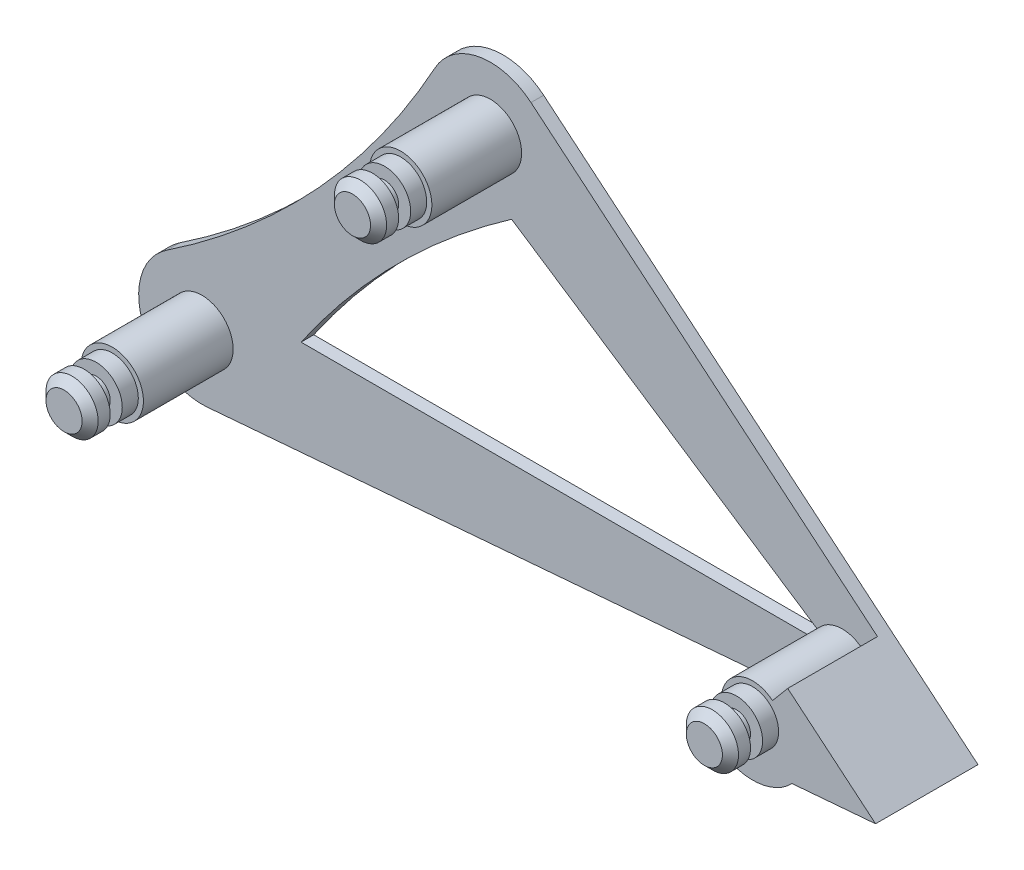
from build123d import *

# Parameters (mm, degrees)
BOSS_EXTRU_1_DEPTH      = 1.58
BOSS_EXTRU_2_START      = 1.58
ESQUISSE1_3_R           = 3.886
BOSS_EXTRU_2_DEPTH      = 11.18
ESQUISSE2_R             = 3.25
BOSS_EXTRU_3_DEPTH      = 6
ENL_V_START             = -4
ESQUISSE3_R             = 3.25
ESQUISSE3_R_2           = 1.75
ENL_V_MAT_EXTRU_1_DEPTH = 1.5
CHANFREIN1_SIZE         = 1
BOSS_EXTRU_4_DEPTH      = 11.18


with BuildPart() as part:
    # Esquisse1 → Boss.-Extru.1 (new body)
    with BuildSketch(Plane(origin=(0, 0, 0), x_dir=(0, 1, 0), z_dir=(0, 0, 1))):
        with BuildLine():
            Line((0, 0), (45.165601039, 54.106615925))
            ThreePointArc((45.165601039, 54.106615925), (46.861742083, 60.617851904), (42.915866667, 66.067912051))
            ThreePointArc((42.915866667, 66.067912051), (22.728037477, 80.578228894), (6.560916882, 99.465313208))
            ThreePointArc((6.560916882, 99.465313208), (-2.597046188, 102.536096098), (-7.8588344, 94.43599857))
            Line((-7.8588344, 94.43599857), (0, 0))
        make_face()
        with BuildLine():
            ThreePointArc((5, 82.745942394), (19.367183897, 70.819861934), (31.370252193, 56.516934969))
            Line((31.370252193, 56.516934969), (6.201435733, 18.446635033))
            ThreePointArc((6.201435733, 18.446635033), (5.626939889, 18.799985682), (5, 19.048679333))
            Line((5, 19.048679333), (5, 82.745942394))
        make_face(mode=Mode.SUBTRACT)
    extrude(amount=BOSS_EXTRU_1_DEPTH)

    # Esquisse1<3> → Boss.-Extru.2 (add)
    with BuildSketch(Plane(origin=(0, 0, 0), x_dir=(0, 1, 0), z_dir=(0, 0, 1)).offset(BOSS_EXTRU_2_START)):
        with Locations(Location((0, 95.09, 0), (0, 0, 90))):
            Circle(ESQUISSE1_3_R)
        with Locations(Location((39.111633766, 59.160176675, 0), (0, 0, 90))):
            Circle(ESQUISSE1_3_R)
        with Locations(Location((3.886, 15.325777239, 0), (0, 0, 73.341295749))):
            Circle(ESQUISSE1_3_R)
    extrude(amount=BOSS_EXTRU_2_DEPTH)

    # Esquisse2 → Boss.-Extru.3 (add)
    with BuildSketch(Plane.XY.offset(12.76)):
        with Locations((-95.09, 0)):
            Circle(ESQUISSE2_R)
        with Locations((-59.160176675, 39.111633766)):
            Circle(ESQUISSE2_R)
        with Locations((-15.325777239, 3.886)):
            Circle(ESQUISSE2_R)
    extrude(amount=BOSS_EXTRU_3_DEPTH)

    # Esquisse3 → Enlèv. mat.-Extru.1 (cut)
    # profile 1 of 3: a face of its own
    with BuildSketch(Plane.XY.offset(18.76).offset(ENL_V_START)):
        with Locations((-95.09, 0)):
            Circle(ESQUISSE3_R)
        with Locations((-95.09, 0)):
            Circle(ESQUISSE3_R_2, mode=Mode.SUBTRACT)
    # profile 2 of 3: a face of its own
    with BuildSketch(Plane.XY.offset(18.76).offset(ENL_V_START)):
        with Locations((-59.160176675, 39.111633766)):
            Circle(ESQUISSE3_R)
        with Locations((-59.160176675, 39.111633766)):
            Circle(ESQUISSE3_R_2, mode=Mode.SUBTRACT)
    # profile 3 of 3: a face of its own
    with BuildSketch(Plane.XY.offset(18.76).offset(ENL_V_START)):
        with Locations((-15.325777239, 3.886)):
            Circle(ESQUISSE3_R)
        with Locations((-15.325777239, 3.886)):
            Circle(ESQUISSE3_R_2, mode=Mode.SUBTRACT)
    extrude(amount=ENL_V_MAT_EXTRU_1_DEPTH, mode=Mode.SUBTRACT)

    # Chanfrein1
    chanfrein1_edges = [part.edges().sort_by_distance(p)[0] for p in [
        (-98.34, 0, 18.76),
        (-62.410176675, 39.111633766, 18.76),
        (-18.575777239, 3.886, 18.76),
    ]]
    chamfer(chanfrein1_edges, length=CHANFREIN1_SIZE)

    # Esquisse4 → Boss.-Extru.4 (add)
    with BuildSketch(Plane.XY.offset(1.58)):
        with BuildLine():
            ThreePointArc((-8.487832844, 3.886), (-8.986317443, 1.323046032), (-10.409092411, -0.866230407))
            Line((-10.409092411, -0.866230407), (0, 0))
            Line((0, 0), (-10.943838689, 9.135390259))
            ThreePointArc((-10.943838689, 9.135390259), (-9.132194444, 6.783760463), (-8.487832844, 3.886))
        make_face()
        with BuildLine():
            ThreePointArc((-19.389322711, -1.613552868), (-14.758693114, -2.928389125), (-10.409092411, -0.866230407))
            Line((-10.409092411, -0.866230407), (-19.389322711, -1.613552868))
        make_face()
        with BuildLine():
            Line((-19.389322711, -1.613552868), (-10.409092411, -0.866230407))
            ThreePointArc((-10.409092411, -0.866230407), (-8.986317443, 1.323046032), (-8.487832844, 3.886))
            ThreePointArc((-8.487832844, 3.886), (-9.132194444, 6.783760463), (-10.943838689, 9.135390259))
            Line((-10.943838689, 9.135390259), (-12.835523996, 6.869225567))
            ThreePointArc((-12.835523996, 6.869225567), (-12.270128411, 1.485165513), (-17.635087873, 0.760607161))
            Line((-17.635087873, 0.760607161), (-19.389322711, -1.613552868))
        make_face()
    extrude(amount=BOSS_EXTRU_4_DEPTH)


solid = part.part
